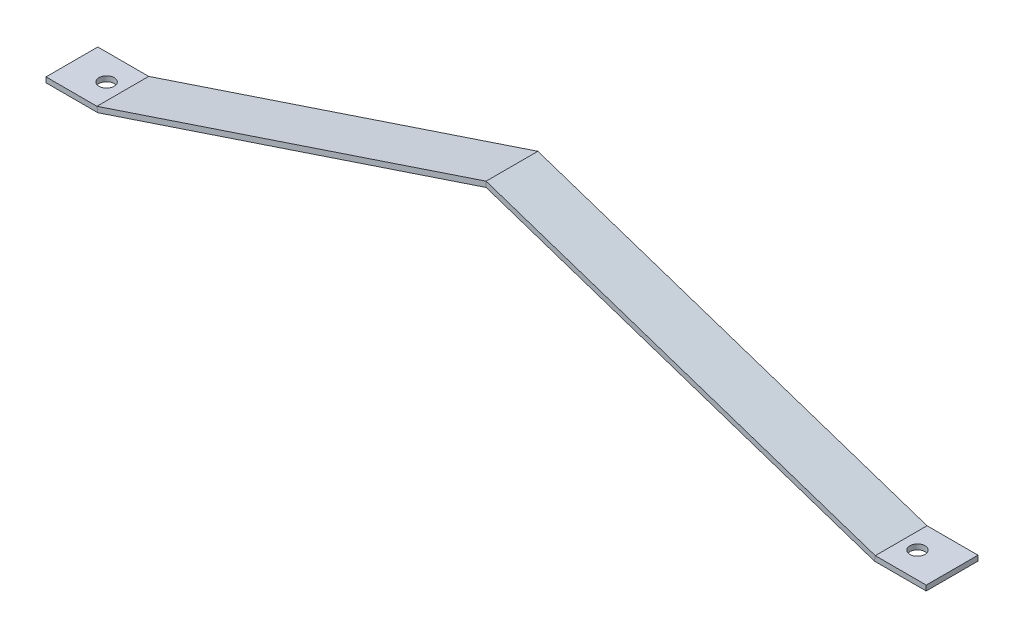
from build123d import *

# Parameters (mm, degrees)
SKETCH7_W                    = 2.54
SKETCH7_H                    = 0.254
F_69_0_0292_DIAMETER_HOLE1_D = 0.74168


with BuildPart() as part:
    # Sweep2: sweep along a path in Sketch1
    with BuildLine(Plane.XY) as sweep2_path:
        Line((-43.18, 0), (-40.64, 0))
        Line((-40.64, 0), (-21.59, 6.35))
        Line((-21.59, 6.35), (-2.54, 0))
        Line((-2.54, 0), (0, 0))
    # Sketch7 → Sweep2 (sweep)
    with BuildSketch(Plane(origin=(0, 0, 0), x_dir=(0, 0, -1), z_dir=(1, 0, 0))):
        with Locations((1.27, 0.127)):
            Rectangle(SKETCH7_W, SKETCH7_H)
    sweep(path=sweep2_path.line, transition=Transition.RIGHT)

    # #69 (0.0292) Diameter Hole1 (through all)
    with Locations(Plane.XZ):
        with Locations((-41.4782, -1.27), (-1.7018, -1.27)):
            Hole(F_69_0_0292_DIAMETER_HOLE1_D / 2)


solid = part.part
